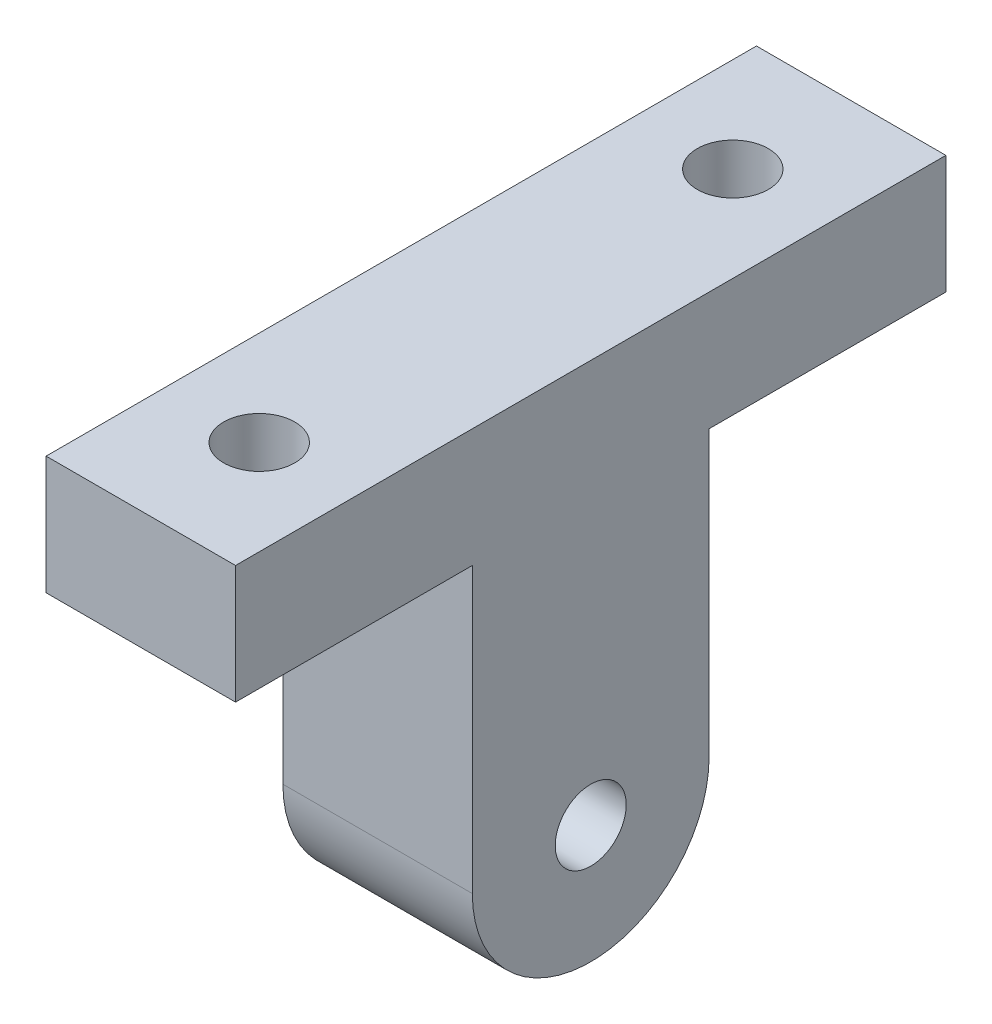
from build123d import *

# Parameters (mm, degrees)
SKETCH_1_R          = 1.5
EXTRUDE_1_DEPTH     = 4
CUT_EXTRUDE_1_REACH = 25.022
SKETCH_2_R          = 1.5


with BuildPart() as part:
    # 草图1 → 凸台-拉伸1 (new, symmetric)
    with BuildSketch(Plane(origin=(0, 0, 0), x_dir=(0, 0, -1), z_dir=(1, 0, 0))):
        with BuildLine():
            Line((5, 12), (15, 12))
            Line((15, 12), (15, 17))
            Line((15, 17), (-15, 17))
            Line((-15, 17), (-15, 12))
            Line((-15, 12), (-5, 12))
            Line((-5, 12), (-5, 0))
            ThreePointArc((-5, 0), (0, -5), (5, 0))
            Line((5, 0), (5, 12))
        make_face()
        Circle(SKETCH_1_R, mode=Mode.SUBTRACT)
    extrude(amount=EXTRUDE_1_DEPTH, both=True)

    # 草图2 → 切除-拉伸1 (cut, up to next)
    with BuildSketch(Plane.XZ.offset(-12), mode=Mode.PRIVATE) as cut_extrude_1_sk1:
        with Locations(Location((0, 10, 0), (0, 0, 270))):
            Circle(SKETCH_2_R)
    cut_extrude_1_tool1 = extrude(cut_extrude_1_sk1.sketch, amount=-CUT_EXTRUDE_1_REACH, mode=Mode.PRIVATE) & part.part
    # 草图2 → 切除-拉伸1 (cut, up to next)
    with BuildSketch(Plane.XZ.offset(-12), mode=Mode.PRIVATE) as cut_extrude_1_sk2:
        with Locations(Location((0, -10, 0), (0, 0, 270))):
            Circle(SKETCH_2_R)
    cut_extrude_1_tool2 = extrude(cut_extrude_1_sk2.sketch, amount=-CUT_EXTRUDE_1_REACH, mode=Mode.PRIVATE) & part.part
    add(cut_extrude_1_tool1.solids().sort_by_distance((0, 12, 10))[0], mode=Mode.SUBTRACT)
    add(cut_extrude_1_tool2.solids().sort_by_distance((0, 12, -10))[0], mode=Mode.SUBTRACT)


solid = part.part
